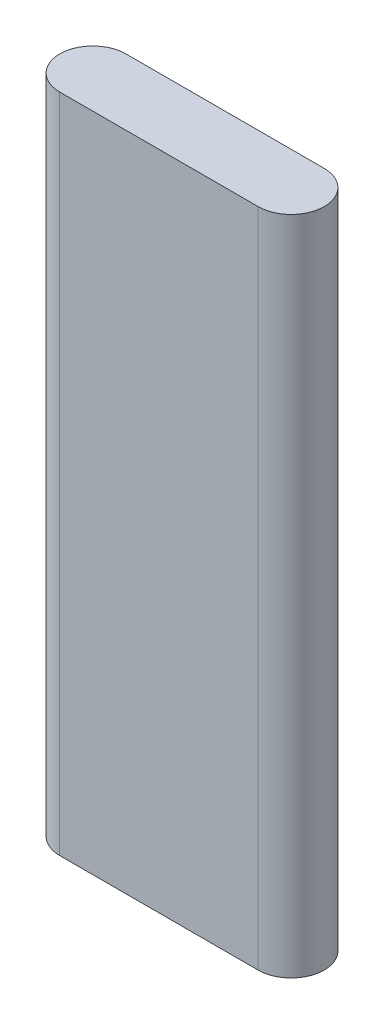
from build123d import *

# Parameters (mm, degrees)
BOSS_EXTRUDE2_DEPTH = 100
CUT_EXTRUDE1_DEPTH  = 30


with BuildPart() as part:
    # Sketch2 → Boss-Extrude2 (new body)
    with BuildSketch(Plane(origin=(0, 0, 0), x_dir=(1, 0, 0), z_dir=(0, 1, 0))):
        with BuildLine():
            Line((-15, -5), (15, -5))
            ThreePointArc((15, -5), (20, 0), (15, 5))
            Line((15, 5), (-15, 5))
            ThreePointArc((-15, 5), (-20, 0), (-15, -5))
        make_face()
    extrude(amount=BOSS_EXTRUDE2_DEPTH)

    # Sketch3 → Cut-Extrude1 (cut)
    with BuildSketch(Plane(origin=(0, 0, 0), x_dir=(-1, 0, 0), z_dir=(0, -1, 0))):
        with BuildLine():
            ThreePointArc((2.55, 0), (1.803122292, 1.803122292), (0, 2.55))
            Line((0, 2.55), (0, -2.55))
            ThreePointArc((0, -2.55), (1.803122292, -1.803122292), (2.55, 0))
        make_face()
        with BuildLine():
            Line((0, -2.55), (0, 2.55))
            ThreePointArc((0, 2.55), (-2.55, 0), (0, -2.55))
        make_face()
    extrude(amount=-CUT_EXTRUDE1_DEPTH, mode=Mode.SUBTRACT)


solid = part.part
